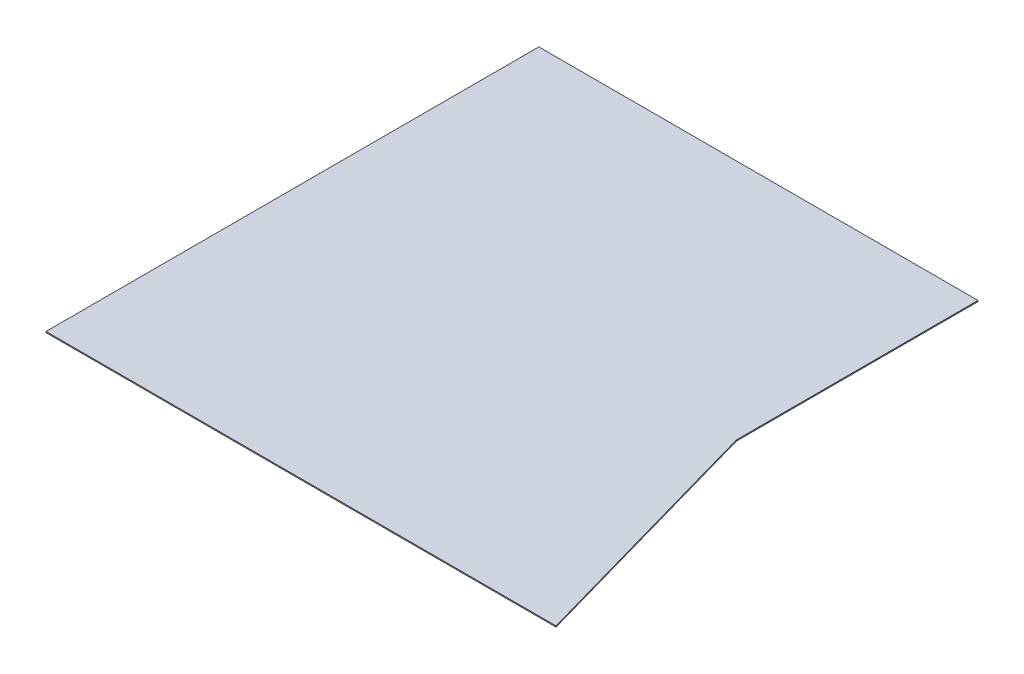
from build123d import *

# Parameters (mm, degrees)
EXTRUDE_1_DEPTH = 2


with BuildPart() as part:
    # 草图1 → 凸台-拉伸1 (new body)
    with BuildSketch(Plane(origin=(0, 0, 0), x_dir=(1, 0, 0), z_dir=(0, 1, 0))):
        Polygon((418.450174718, 85.999000358), (418.450174718, -364.000999642), (550.450174718, -832.000999642), (-399.549825282, -832.000999642), (-399.549825282, 85.999000358), align=None)
    extrude(amount=EXTRUDE_1_DEPTH)


solid = part.part
